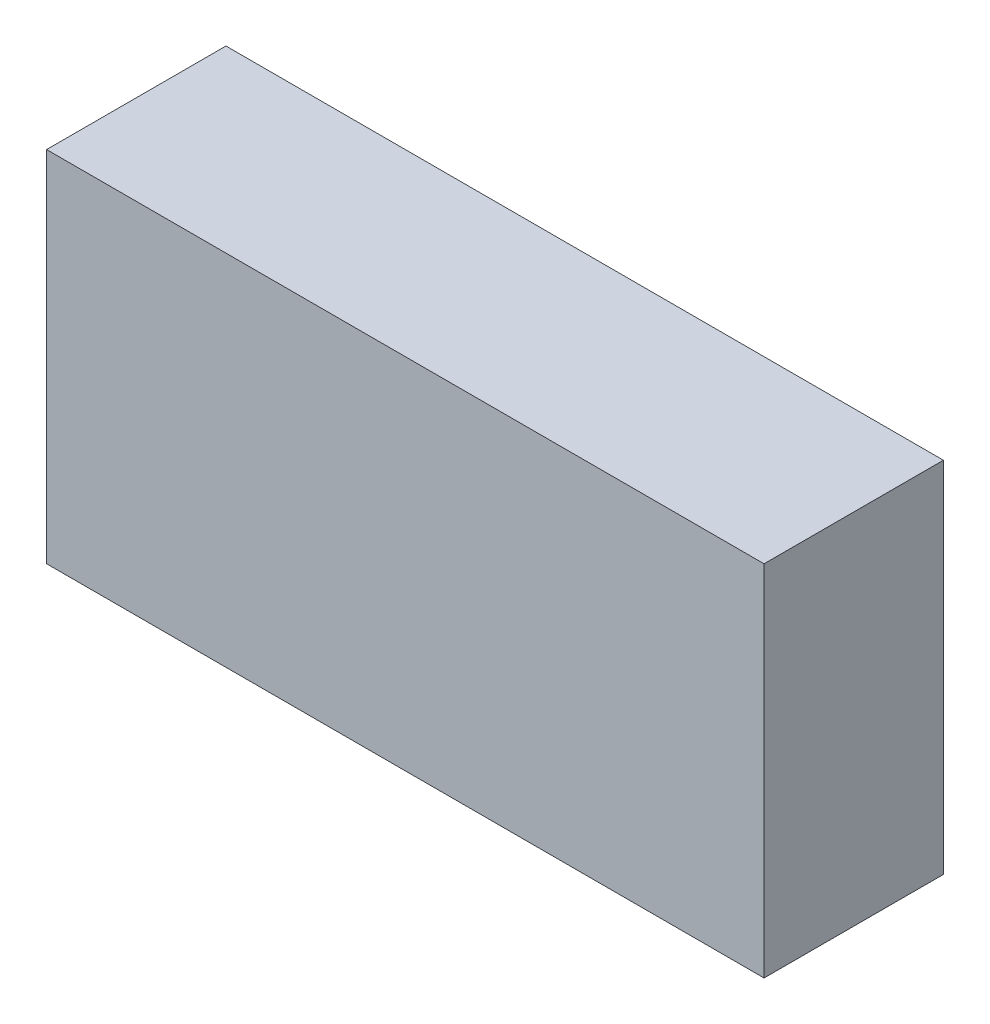
from build123d import *

# Parameters (mm, degrees)
SKETCH1_W           = 40
SKETCH1_H           = 20
BOSS_EXTRUDE1_DEPTH = 5


with BuildPart() as part:
    # Sketch1 → Boss-Extrude1 (new, symmetric)
    with BuildSketch(Plane.XY):
        with Locations((20, 10)):
            Rectangle(SKETCH1_W, SKETCH1_H)
    extrude(amount=BOSS_EXTRUDE1_DEPTH, both=True)


solid = part.part
